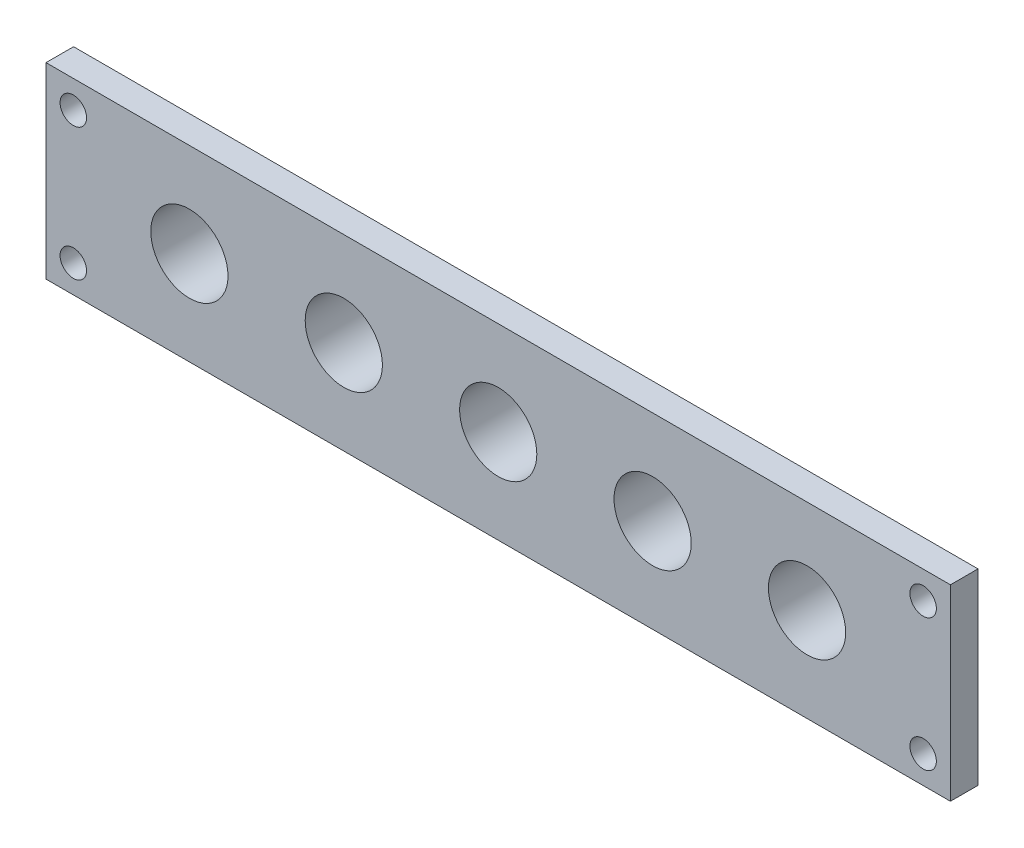
from build123d import *

# Parameters (mm, degrees)
SKETCH_1_W             = 73
SKETCH_1_H             = 8.4
EXTRUDE_1_DEPTH        = 3
SKETCH_2_W             = 82
SKETCH_2_H             = 17
EXTRUDE_2_DEPTH        = 2.5
SKETCH_3_R             = 3.5
CUT_EXTRUDE_1_DEPTH    = 10
PATTERN_LINEAR_1_COUNT = 3
PATTERN_LINEAR_1_PITCH = 14
PATTERN_LINEAR_2_COUNT = 3
PATTERN_LINEAR_2_PITCH = 14
SKETCH_4_R             = 1.2
CUT_EXTRUDE_4_DEPTH    = 6


with BuildPart() as part:
    # Эскиз1 → Бобышка-Вытянуть1 (new body)
    with BuildSketch(Plane.XY):
        Rectangle(SKETCH_1_W, SKETCH_1_H)
    extrude(amount=EXTRUDE_1_DEPTH)

    # Эскиз2 → Бобышка-Вытянуть2 (add)
    with BuildSketch(Plane.XY.offset(3)):
        Rectangle(SKETCH_2_W, SKETCH_2_H)
    extrude(amount=EXTRUDE_2_DEPTH)

    # Эскиз3 → Вырез-Вытянуть1 (cut)
    with BuildSketch(Plane(origin=(0, 0, 0), x_dir=(-1, 0, 0), z_dir=(0, 0, -1))):
        Circle(SKETCH_3_R)
    cut_extrude_1 = extrude(amount=-CUT_EXTRUDE_1_DEPTH, mode=Mode.SUBTRACT)

    # Линейный массив1: Вырез-Вытянуть1 ×3
    with Locations(*[(i * PATTERN_LINEAR_1_PITCH, 0, 0) for i in range(1, PATTERN_LINEAR_1_COUNT)]):
        add(cut_extrude_1, mode=Mode.SUBTRACT)

    # Линейный массив2: Вырез-Вытянуть1 ×3
    with Locations(*[(-i * PATTERN_LINEAR_2_PITCH, 0, 0) for i in range(1, PATTERN_LINEAR_2_COUNT)]):
        add(cut_extrude_1, mode=Mode.SUBTRACT)

    # Эскиз4 → Вырез-Вытянуть4 (cut)
    with BuildSketch(Plane.XY.offset(5.5)):
        with Locations((-38.524276055, 5.998931776)):
            Circle(SKETCH_4_R)
        with Locations((-38.524276055, -5.998931776)):
            Circle(SKETCH_4_R)
        with Locations((38.524276055, -5.998931776)):
            Circle(SKETCH_4_R)
        with Locations((38.524276055, 5.998931776)):
            Circle(SKETCH_4_R)
    extrude(amount=-CUT_EXTRUDE_4_DEPTH, mode=Mode.SUBTRACT)


solid = part.part
